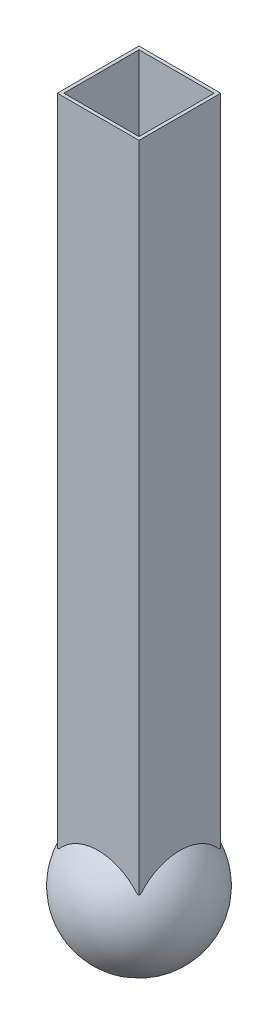
from build123d import *

# Parameters (mm, degrees)
SKETCH1_W           = 25
SKETCH1_H           = 25
SKETCH1_W_2         = 23
SKETCH1_H_2         = 23
BOSS_EXTRUDE1_DEPTH = 200


with BuildPart() as part:
    # Sketch1 → Boss-Extrude1 (new body)
    with BuildSketch(Plane(origin=(0, 0, 0), x_dir=(1, 0, 0), z_dir=(0, 1, 0))):
        Rectangle(SKETCH1_W, SKETCH1_H)
        Rectangle(SKETCH1_W_2, SKETCH1_H_2, mode=Mode.SUBTRACT)
    extrude(amount=BOSS_EXTRUDE1_DEPTH)

    # Sketch2 → Revolve1 (revolve)
    with BuildSketch(Plane(origin=(0, -10, 0), x_dir=(-1, 0, 0), z_dir=(0, -1, 0))):
        with BuildLine():
            Line((0, 19), (0, 20))
            ThreePointArc((0, 20), (-20, 0), (0, -20))
            Line((0, -20), (0, -19))
            ThreePointArc((0, -19), (-19, 0), (0, 19))
        make_face()
    revolve(axis=Axis((0, -10, -20), (0, 0, 1)))


solid = part.part
